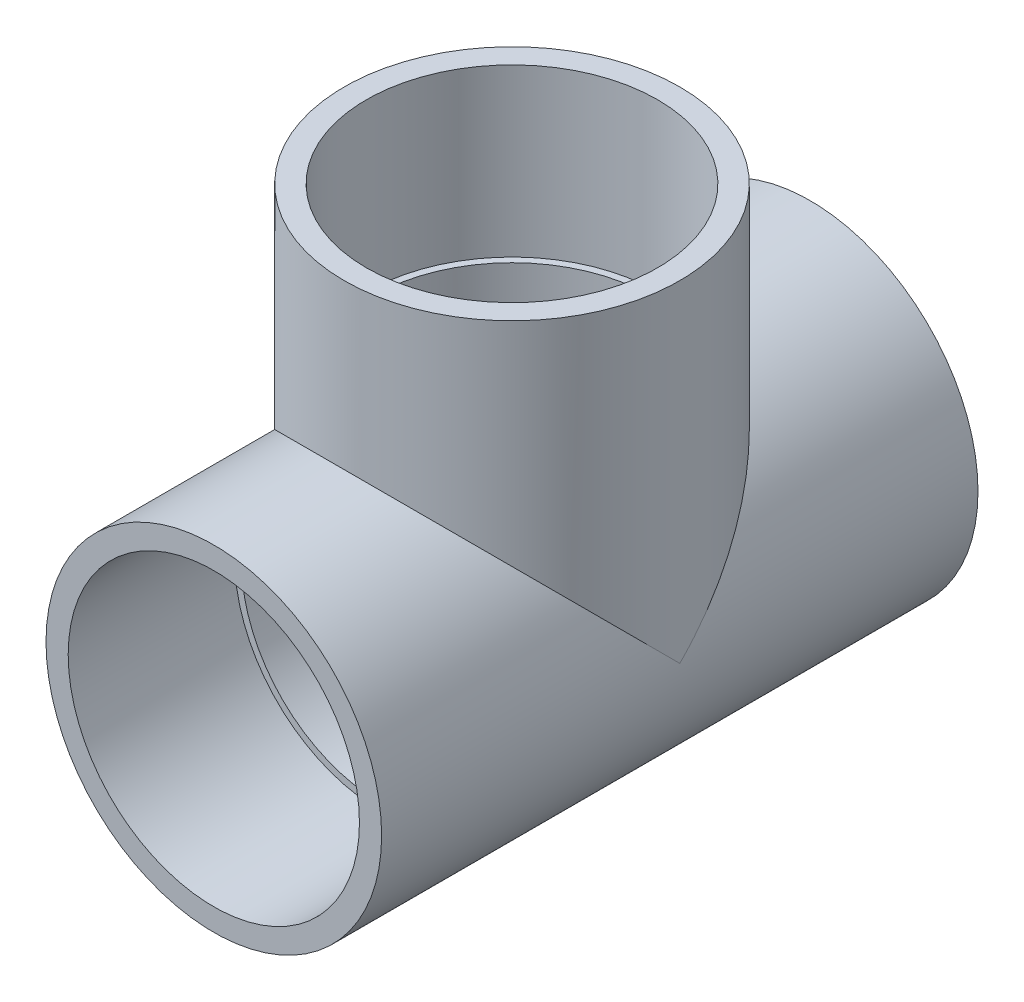
from build123d import *
from build123d.topology import SkipClean

# Parameters (mm, degrees)
SKETCH1_W               = 19.20875
SKETCH1_H               = 68.2625
SKETCH2_W               = 19.20875
SKETCH2_H               = 37.94125
SKETCH7_R               = 15.875
CUT_EXTRUDE1_DEPTH      = 81.425639161
CUT_EXTRUDE2_REACH      = 71.282
CUT_EXTRUDE2_END_RADIUS = 15.875
SKETCH8_R               = 15.875
SKETCH9_R               = 16.66875
CUT_EXTRUDE3_DEPTH      = 19.05
CUT_EXTRUDE4_START      = -19.05
SKETCH10_R              = 16.66875
CUT_EXTRUDE4_DEPTH      = 19.05
SKETCH11_R              = 16.66875
CUT_EXTRUDE5_DEPTH      = 19.05


with BuildPart() as part:
    # Sketch1 → Revolve1 (revolve)
    with BuildSketch(Plane(origin=(0, 0, 0), x_dir=(1, 0, 0), z_dir=(0, 1, 0)), mode=Mode.PRIVATE) as revolve1_sk:
        with Locations((9.604375, 0)):
            Rectangle(SKETCH1_W, SKETCH1_H)
    revolve(revolve1_sk.sketch.rotate(Axis((0, 0, 118.243982537), (0, 0, -1)), 180), axis=Axis((0, 0, 118.243982537), (0, 0, -1)))

    # Sketch2 → Revolve2 (revolve)
    with BuildSketch(Plane.XY, mode=Mode.PRIVATE) as revolve2_sk:
        with Locations((-9.604375, 18.970625)):
            Rectangle(SKETCH2_W, SKETCH2_H)
    revolve(revolve2_sk.sketch.rotate(Axis((0, 0, 0), (0, 1, 0)), 90), axis=Axis((0, 0, 0), (0, 1, 0)))

    # Sketch7 → Cut-Extrude1 (cut, through all)
    with BuildSketch(Plane.XY.offset(34.13125)):
        Circle(SKETCH7_R)
    extrude(amount=-CUT_EXTRUDE1_DEPTH, mode=Mode.SUBTRACT)

    # Cut-Extrude2: up to this cylinder (the profile starts outside it)
    cut_extrude2_end = Plane(origin=(0, 0, 0), z_dir=(0, 0, 1)) * Cylinder(CUT_EXTRUDE2_END_RADIUS, 175.314, mode=Mode.PRIVATE)
    # Sketch8 → Cut-Extrude2 (cut, up to the surface)
    with BuildSketch(Plane(origin=(0, 37.94125, 0), x_dir=(1, 0, 0), z_dir=(0, 1, 0)), mode=Mode.PRIVATE) as cut_extrude2_sk1:
        with Locations(Location((0, 0, 0), (0, 0, 270))):
            Circle(SKETCH8_R)
    cut_extrude2_tool1 = extrude(cut_extrude2_sk1.sketch, amount=-CUT_EXTRUDE2_REACH, mode=Mode.PRIVATE) - cut_extrude2_end
    add(cut_extrude2_tool1.solids().sort_by_distance((0, 37.94125, 0))[0], mode=Mode.SUBTRACT)

    # Sketch9 → Cut-Extrude3 (cut)
    with SkipClean():  # the faces are left unmerged after this step: merging them gives an invalid solid
        with BuildSketch(Plane.XY.offset(34.13125)):
            Circle(SKETCH9_R)
        extrude(amount=-CUT_EXTRUDE3_DEPTH, mode=Mode.SUBTRACT)

    # Sketch10 → Cut-Extrude4 (cut)
    with BuildSketch(Plane(origin=(0, 0, -34.13125), x_dir=(-1, 0, 0), z_dir=(0, 0, -1)).offset(CUT_EXTRUDE4_START)):
        with Locations(Location((0, 0, 0), (0, 0, 180))):
            Circle(SKETCH10_R)
    extrude(amount=CUT_EXTRUDE4_DEPTH, mode=Mode.SUBTRACT)

    # Sketch11 → Cut-Extrude5 (cut)
    with BuildSketch(Plane(origin=(0, 37.94125, 0), x_dir=(1, 0, 0), z_dir=(0, 1, 0))):
        with Locations(Location((0, 0, 0), (0, 0, 270))):
            Circle(SKETCH11_R)
    extrude(amount=-CUT_EXTRUDE5_DEPTH, mode=Mode.SUBTRACT)


solid = part.part
